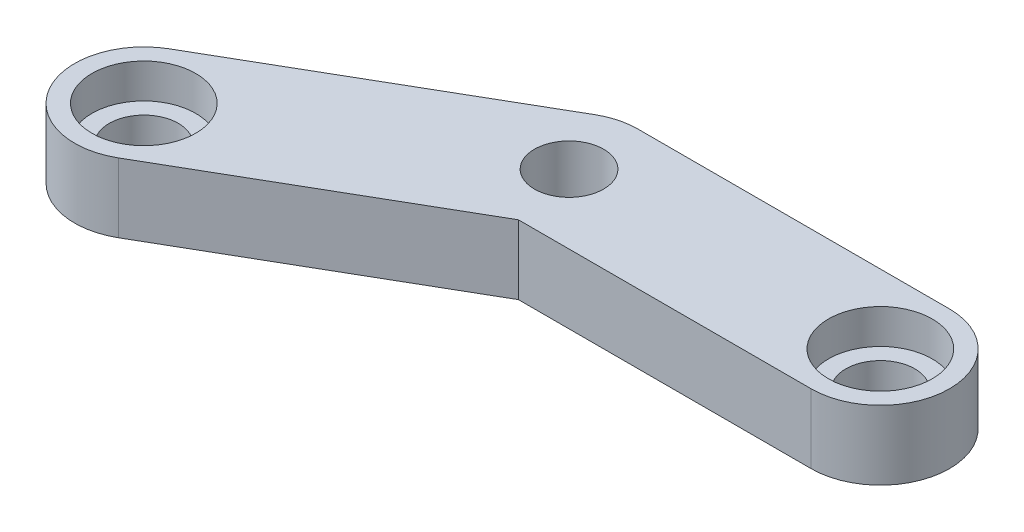
from build123d import *

# Parameters (mm, degrees)
SKETCH1_R           = 2.5
BOSS_EXTRUDE1_DEPTH = 5
BOSS_EXTRUDE2_START = -5
SKETCH2_R           = 2.5
BOSS_EXTRUDE2_DEPTH = 5
SKETCH3_R           = 3.75
CUT_EXTRUDE1_DEPTH  = 2.5


with BuildPart() as part:
    # Sketch1 → Boss-Extrude1 (new body)
    with BuildSketch(Plane(origin=(0, 0, 0), x_dir=(1, 0, 0), z_dir=(0, 1, 0))):
        with BuildLine():
            Line((0, 5), (22.5, 5))
            ThreePointArc((22.5, 5), (27.5, 0), (22.5, -5))
            Line((22.5, -5), (0, -5))
            ThreePointArc((0, -5), (-5, 0), (0, 5))
        make_face()
        with Locations(Location((0, 0, 0), (0, 0, 270))):
            Circle(SKETCH1_R, mode=Mode.SUBTRACT)
        with Locations(Location((22.5, 0, 0), (0, 0, 270))):
            Circle(SKETCH1_R, mode=Mode.SUBTRACT)
    extrude(amount=BOSS_EXTRUDE1_DEPTH)

    # Sketch2 → Boss-Extrude2 (add)
    with BuildSketch(Plane(origin=(0, 5, 0), x_dir=(1, 0, 0), z_dir=(0, 1, 0)).offset(BOSS_EXTRUDE2_START)):
        with BuildLine():
            Line((2.5, -4.330127019), (-16.985571585, -15.580127019))
            ThreePointArc((-16.985571585, -15.580127019), (-23.815698604, -13.75), (-21.985571585, -6.919872981))
            Line((-21.985571585, -6.919872981), (-2.5, 4.330127019))
            ThreePointArc((-2.5, 4.330127019), (4.330127019, 2.5), (2.5, -4.330127019))
        make_face()
        with Locations(Location((-19.485571585, -11.25, 0), (0, 0, 270))):
            Circle(SKETCH2_R, mode=Mode.SUBTRACT)
        with Locations(Location((0, 0, 0), (0, 0, 270))):
            Circle(SKETCH2_R, mode=Mode.SUBTRACT)
    extrude(amount=BOSS_EXTRUDE2_DEPTH)

    # Sketch3 → Cut-Extrude1 (cut)
    with BuildSketch(Plane(origin=(0, 5, 0), x_dir=(1, 0, 0), z_dir=(0, 1, 0))):
        with Locations(Location((22.5, 0, 0), (0, 0, 270))):
            Circle(SKETCH3_R)
        with Locations(Location((-19.485571585, -11.25, 0), (0, 0, 270))):
            Circle(SKETCH3_R)
    extrude(amount=-CUT_EXTRUDE1_DEPTH, mode=Mode.SUBTRACT)


solid = part.part
